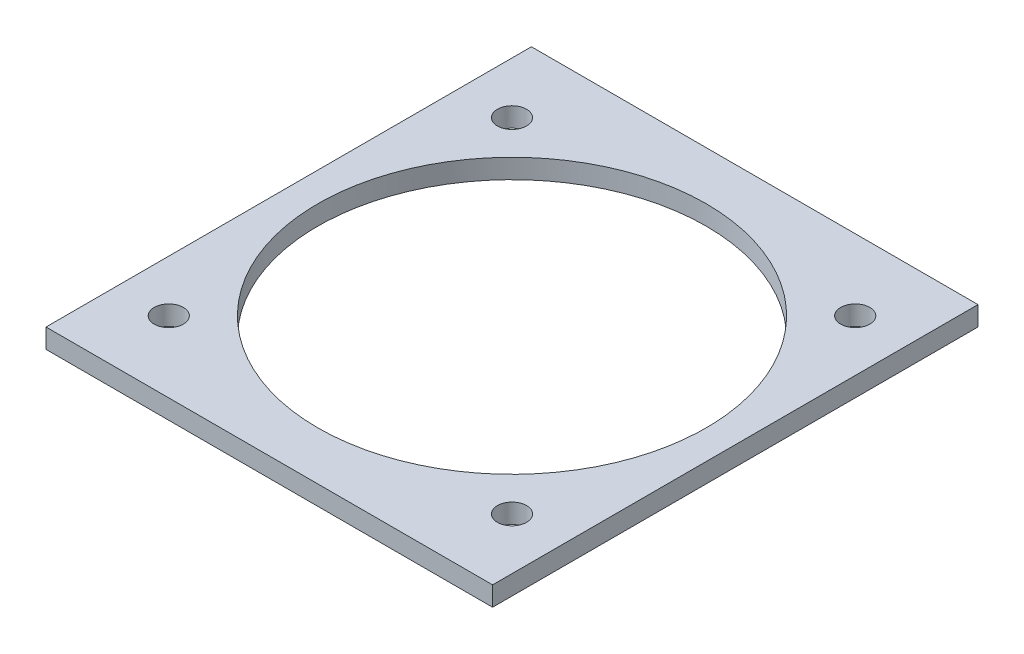
from build123d import *

# Parameters (mm, degrees)
SKETCH1_W           = 46
SKETCH1_H           = 50
BOSS_EXTRUDE1_DEPTH = 2
SKETCH2_R           = 20
CUT_EXTRUDE1_DEPTH  = 35.029399054
SKETCH3_R           = 1.5
CUT_EXTRUDE2_DEPTH  = 35.029399054


with BuildPart() as part:
    # Sketch1 → Boss-Extrude1 (new body)
    with BuildSketch(Plane(origin=(0, 0, 0), x_dir=(1, 0, 0), z_dir=(0, 1, 0))):
        Rectangle(SKETCH1_W, SKETCH1_H)
    extrude(amount=BOSS_EXTRUDE1_DEPTH)

    # Sketch2 → Cut-Extrude1 (cut, through all)
    with BuildSketch(Plane(origin=(0, 2, 0), x_dir=(1, 0, 0), z_dir=(0, 1, 0))):
        with Locations(Location((0, 0, 0), (0, 0, 270))):
            Circle(SKETCH2_R)
    extrude(amount=-CUT_EXTRUDE1_DEPTH, mode=Mode.SUBTRACT)

    # Sketch3 → Cut-Extrude2 (cut, through all)
    with BuildSketch(Plane(origin=(0, 2, 0), x_dir=(1, 0, 0), z_dir=(0, 1, 0))):
        with Locations(Location((-17.67766953, 17.67766953, 0), (0, 0, 270))):
            Circle(SKETCH3_R)
        with Locations(Location((-17.67766953, -17.67766953, 0), (0, 0, 270))):
            Circle(SKETCH3_R)
        with Locations(Location((17.67766953, -17.67766953, 0), (0, 0, 270))):
            Circle(SKETCH3_R)
        with Locations(Location((17.67766953, 17.67766953, 0), (0, 0, 270))):
            Circle(SKETCH3_R)
    extrude(amount=-CUT_EXTRUDE2_DEPTH, mode=Mode.SUBTRACT)


solid = part.part
